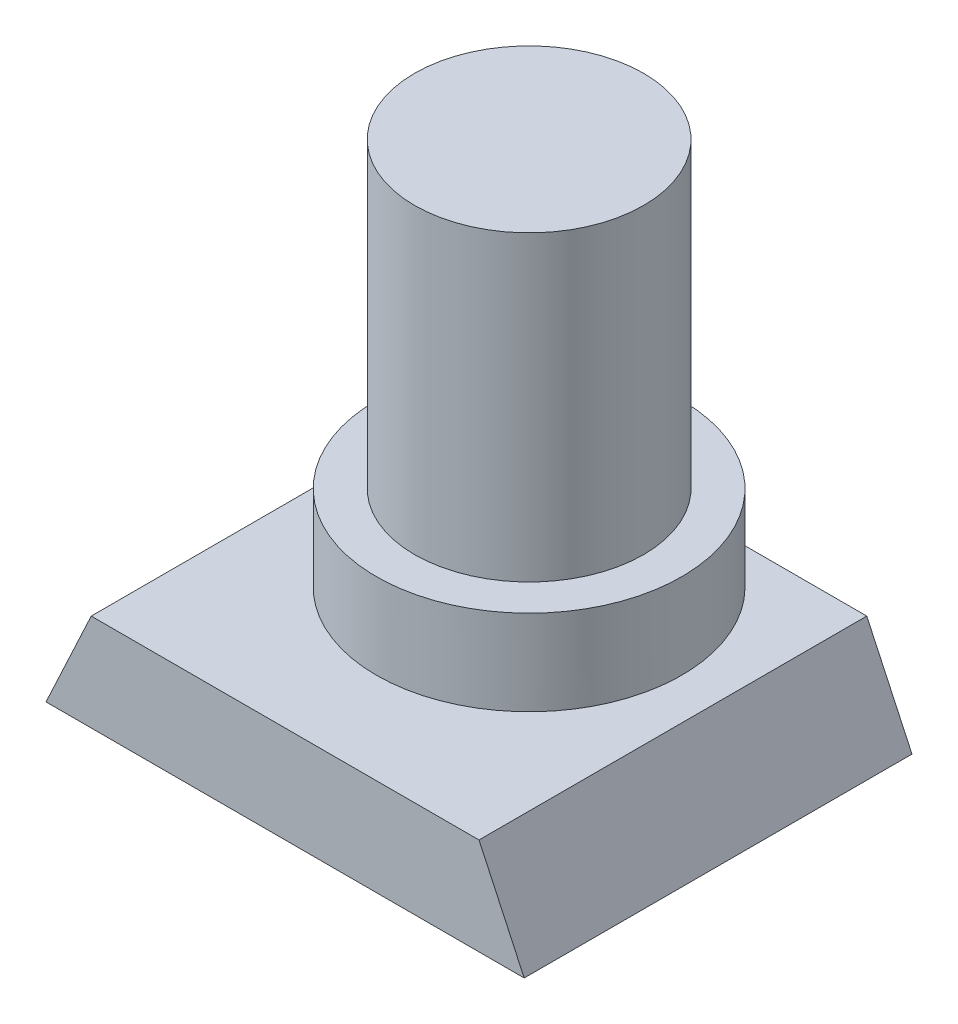
from build123d import *

# Parameters (mm, degrees)
BOSS_EXTRUDE1_DEPTH = 12.7
SKETCH2_R           = 3.75
BOSS_EXTRUDE2_DEPTH = 12.7
SKETCH3_R           = 5
BOSS_EXTRUDE3_DEPTH = 2.796


with BuildPart() as part:
    # Sketch1 → Boss-Extrude1 (new body)
    with BuildSketch(Plane.XY):
        Polygon((-7.830526815, 0), (7.830526815, 0), (6.35, 3.175), (-6.35, 3.175), align=None)
    extrude(amount=BOSS_EXTRUDE1_DEPTH)

    # Sketch2 → Boss-Extrude2 (add)
    with BuildSketch(Plane(origin=(0, 3.175, 0), x_dir=(1, 0, 0), z_dir=(0, 1, 0))):
        with Locations(Location((0, -4.708818534, 0), (0, 0, 270))):
            Circle(SKETCH2_R)
    extrude(amount=BOSS_EXTRUDE2_DEPTH)

    # Sketch3 → Boss-Extrude3 (add)
    with BuildSketch(Plane(origin=(0, 3.175, 0), x_dir=(1, 0, 0), z_dir=(0, 1, 0))):
        with Locations(Location((0, -4.708818534, 0), (0, 0, 109.650110836))):
            Circle(SKETCH3_R)
    extrude(amount=BOSS_EXTRUDE3_DEPTH)


solid = part.part
